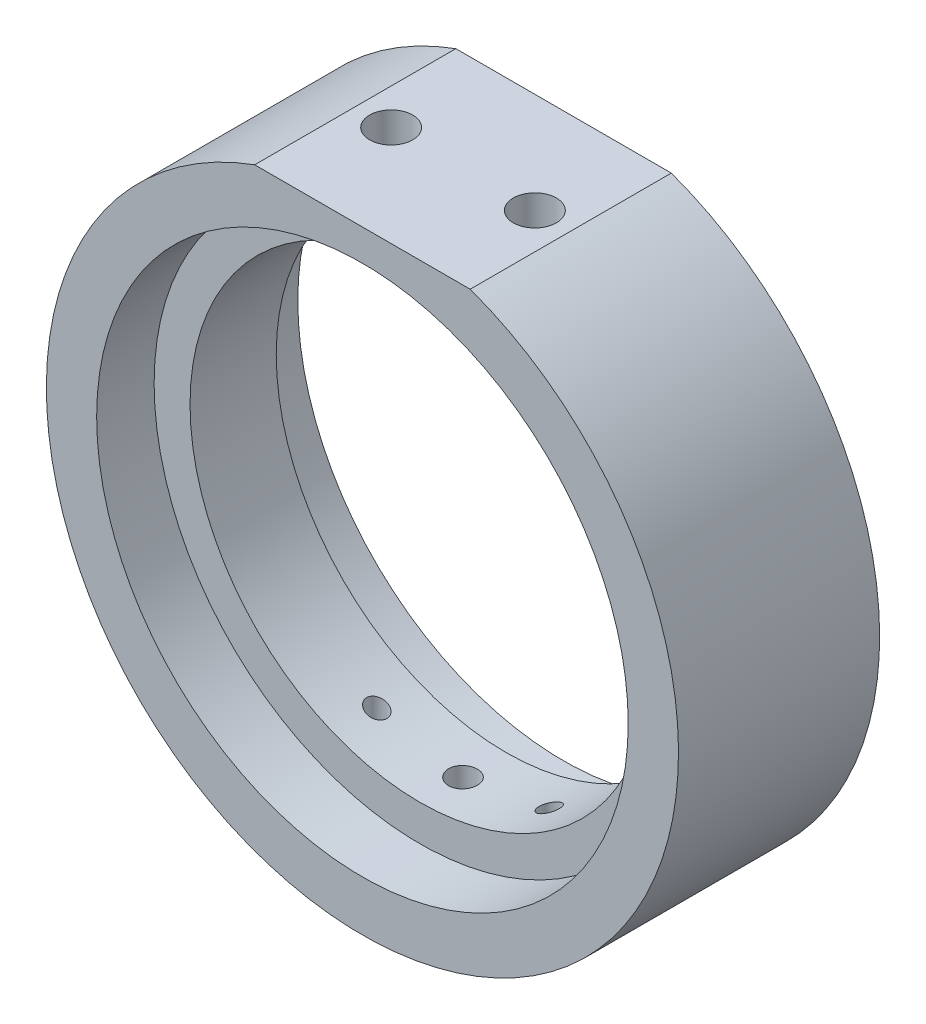
from build123d import *

# Parameters (mm, degrees)
SKETCH_1_R               = 22
SKETCH_1_R_2             = 18.5
EXTRUDE_1_DEPTH          = 10
EXTRUDE_START            = -6
SKETCH_2_R               = 18.5
SKETCH_2_R_2             = 16
EXTRUDE_2_DEPTH          = 6
CUT_EXTRUDE_3_DEPTH      = 33.680269277
CUT_EXTRUDE_4_REACH      = 51.049
CUT_EXTRUDE_4_END_RADIUS = 16
SKETCH_8_R               = 1.5
SKETCH_10_R              = 1
SKETCH_10_R_2            = 0.7
CUT_EXTRUDE_5_DEPTH      = 33.680269307
SKETCH_11_R              = 18.5
EXTRUDE_3_DEPTH          = 4


with BuildPart() as part:
    # 草图1 → 凸台-拉伸1 (new body)
    with BuildSketch(Plane.XY):
        Circle(SKETCH_1_R)
        Circle(SKETCH_1_R_2, mode=Mode.SUBTRACT)
    extrude(amount=EXTRUDE_1_DEPTH)

    # 草图2 → 凸台-拉伸2 (add)
    with BuildSketch(Plane.XY.offset(10).offset(EXTRUDE_START)):
        Circle(SKETCH_2_R)
        Circle(SKETCH_2_R_2, mode=Mode.SUBTRACT)
    extrude(amount=EXTRUDE_2_DEPTH)

    # 草图7 → 切除-拉伸3 (cut, through all)
    with BuildSketch(Plane.XY.offset(10)):
        with BuildLine():
            Line((-7.5, 20.68211788), (7.5, 20.68211788))
            ThreePointArc((7.5, 20.68211788), (0, 22), (-7.5, 20.68211788))
        make_face()
    extrude(amount=-CUT_EXTRUDE_3_DEPTH, mode=Mode.SUBTRACT)

    # 切除-拉伸4: up to this cylinder (the profile starts outside it)
    cut_extrude_4_end = Plane(origin=(0, 0, 7), z_dir=(0, 0, 1)) * Cylinder(CUT_EXTRUDE_4_END_RADIUS, 135.098, mode=Mode.PRIVATE)
    # 草图8 → 切除-拉伸4 (cut, up to the surface)
    with BuildSketch(Plane(origin=(0, 20.68211788, 0), x_dir=(1, 0, 0), z_dir=(0, 1, 0)), mode=Mode.PRIVATE) as cut_extrude_4_sk1:
        with Locations(Location((-5, -7, 0), (0, 0, 270))):
            Circle(SKETCH_8_R)
    cut_extrude_4_tool1 = extrude(cut_extrude_4_sk1.sketch, amount=-CUT_EXTRUDE_4_REACH, mode=Mode.PRIVATE) - cut_extrude_4_end
    add(cut_extrude_4_tool1.solids().sort_by_distance((-5, 20.682118, 7))[0], mode=Mode.SUBTRACT)
    # 草图8 → 切除-拉伸4 (cut, up to the surface)
    with BuildSketch(Plane(origin=(0, 20.68211788, 0), x_dir=(1, 0, 0), z_dir=(0, 1, 0)), mode=Mode.PRIVATE) as cut_extrude_4_sk2:
        with Locations(Location((5, -7, 0), (0, 0, 270))):
            Circle(SKETCH_8_R)
    cut_extrude_4_tool2 = extrude(cut_extrude_4_sk2.sketch, amount=-CUT_EXTRUDE_4_REACH, mode=Mode.PRIVATE) - cut_extrude_4_end
    add(cut_extrude_4_tool2.solids().sort_by_distance((5, 20.682118, 7))[0], mode=Mode.SUBTRACT)

    # 草图10 → 切除-拉伸5 (cut, through all)
    with BuildSketch(Plane(origin=(0, 0, 0), x_dir=(1, 0, 0), z_dir=(0, 1, 0))):
        with Locations(Location((0, -7, 0), (0, 0, 270))):
            Circle(SKETCH_10_R)
        with Locations(Location((-6, -7, 0), (0, 0, 270))):
            Circle(SKETCH_10_R_2)
        with Locations(Location((6, -7, 0), (0, 0, 270))):
            Circle(SKETCH_10_R_2)
    extrude(amount=-CUT_EXTRUDE_5_DEPTH, mode=Mode.SUBTRACT)

    # 草图11 → 凸台-拉伸3 (add)
    with BuildSketch(Plane.XY.offset(10)):
        with BuildLine():
            Line((-7.5, 20.68211788), (7.5, 20.68211788))
            ThreePointArc((7.5, 20.68211788), (0, -22), (-7.5, 20.68211788))
        make_face()
        Circle(SKETCH_11_R, mode=Mode.SUBTRACT)
    extrude(amount=EXTRUDE_3_DEPTH)


solid = part.part
